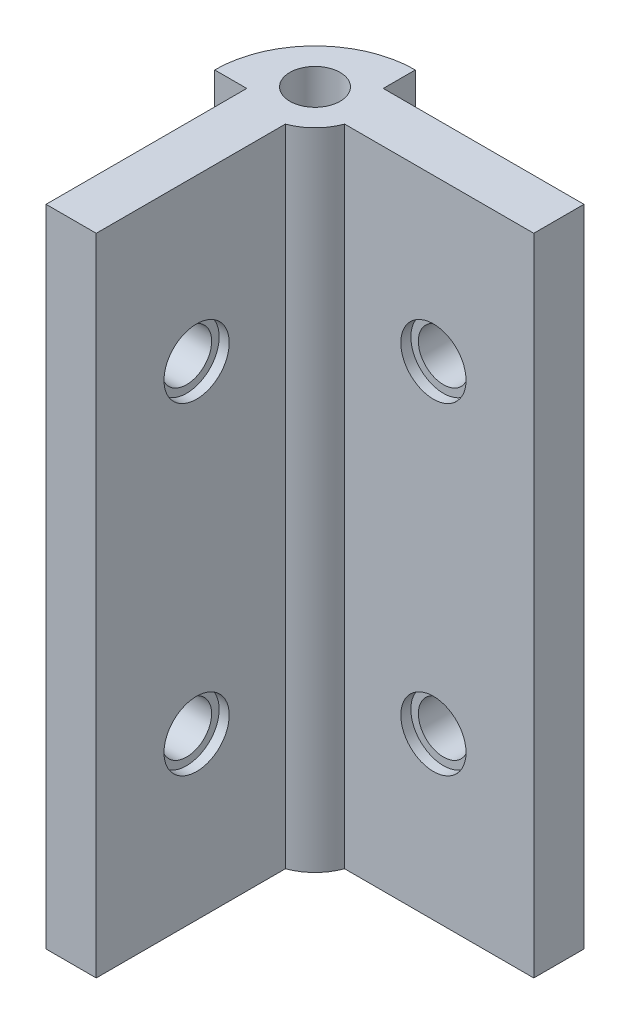
from build123d import *

# Parameters (mm, degrees)
SKETCH4_R           = 2.5
BOSS_EXTRUDE1_DEPTH = 64.27
SKETCH5_R           = 2.5
CUT_EXTRUDE1_DEPTH  = 72.548291037
SKETCH6_R           = 2.5
CUT_EXTRUDE2_DEPTH  = 74.179063133
SKETCH7_R           = 3.25
CUT_EXTRUDE3_DEPTH  = 1
SKETCH8_R           = 3.25
CUT_EXTRUDE4_DEPTH  = 1


with BuildPart() as part:
    # Sketch4 → Boss-Extrude1 (new body)
    with BuildSketch(Plane(origin=(0, 0, 0), x_dir=(1, 0, 0), z_dir=(0, 1, 0))):
        with BuildLine():
            Line((-5.286754077, 14.301163994), (13.559651759, 14.301163994))
            Line((13.559651759, 14.301163994), (13.559651759, 19.301163994))
            Line((13.559651759, 19.301163994), (-6.440348241, 19.301163994))
            Line((-6.440348241, 19.301163994), (-6.440348241, 22.501163994))
            ThreePointArc((-6.440348241, 22.501163994), (-13.511416053, 19.572231806), (-16.440348241, 12.501163994))
            Line((-16.440348241, 12.501163994), (-13.240348241, 12.501163994))
            Line((-13.240348241, 12.501163994), (-13.240348241, -7.498836006))
            Line((-13.240348241, -7.498836006), (-8.240348241, -7.498836006))
            Line((-8.240348241, -7.498836006), (-8.240348241, 11.347569829))
            ThreePointArc((-8.240348241, 11.347569829), (-6.440348241, 12.501163994), (-5.286754077, 14.301163994))
        make_face()
        with Locations(Location((-9.975882147, 16.0366979, 0), (0, 0, 270))):
            Circle(SKETCH4_R, mode=Mode.SUBTRACT)
    extrude(amount=BOSS_EXTRUDE1_DEPTH)

    # Sketch5 → Cut-Extrude1 (cut, through all)
    with BuildSketch(Plane(origin=(0, 0, -19.301163994), x_dir=(-1, 0, 0), z_dir=(0, 0, -1))):
        with Locations((-3.559651759, 48.2025)):
            Circle(SKETCH5_R)
        with Locations((-3.559651759, 16.0675)):
            Circle(SKETCH5_R)
    extrude(amount=-CUT_EXTRUDE1_DEPTH, mode=Mode.SUBTRACT)

    # Sketch6 → Cut-Extrude2 (cut, through all)
    with BuildSketch(Plane.ZY.offset(13.240348241)):
        with Locations((-2.501163994, 48.2025)):
            Circle(SKETCH6_R)
        with Locations((-2.501163994, 16.0675)):
            Circle(SKETCH6_R)
    extrude(amount=-CUT_EXTRUDE2_DEPTH, mode=Mode.SUBTRACT)

    # Sketch7 → Cut-Extrude3 (cut)
    with BuildSketch(Plane(origin=(-8.240348241, 0, 0), x_dir=(0, 0, -1), z_dir=(1, 0, 0))):
        with Locations((2.501163994, 48.2025)):
            Circle(SKETCH7_R)
        with Locations((2.501163994, 16.0675)):
            Circle(SKETCH7_R)
    extrude(amount=-CUT_EXTRUDE3_DEPTH, mode=Mode.SUBTRACT)

    # Sketch8 → Cut-Extrude4 (cut)
    with BuildSketch(Plane.XY.offset(-14.301163994)):
        with Locations((3.559651759, 48.2025)):
            Circle(SKETCH8_R)
        with Locations((3.559651759, 16.0675)):
            Circle(SKETCH8_R)
    extrude(amount=-CUT_EXTRUDE4_DEPTH, mode=Mode.SUBTRACT)


solid = part.part
